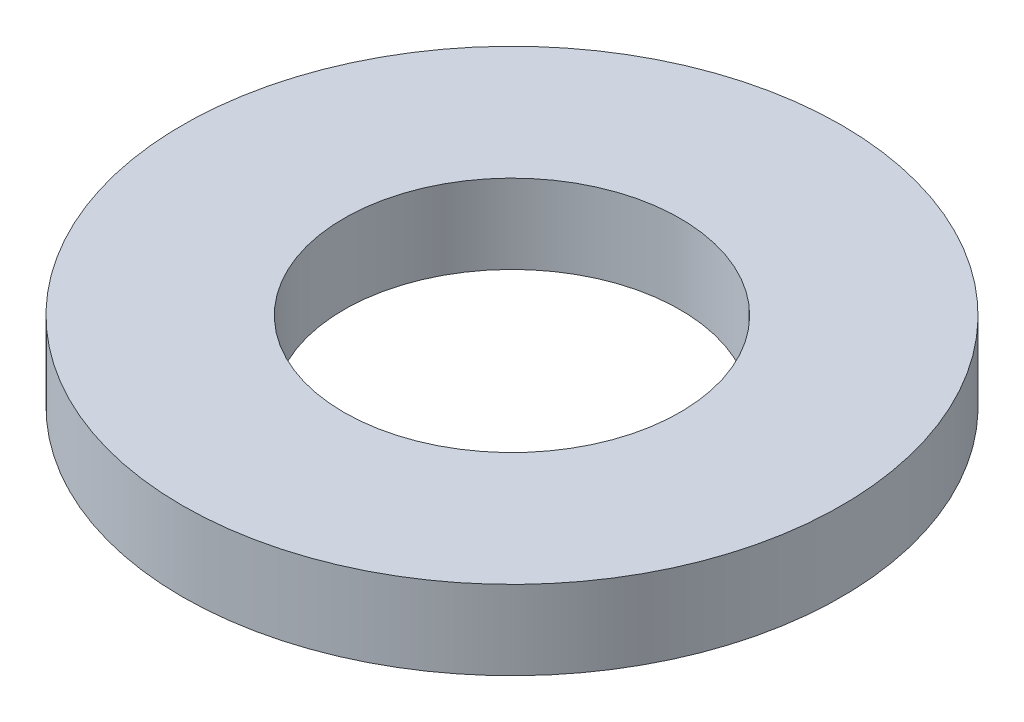
from build123d import *

# Parameters (mm, degrees)
SKETCH1_R           = 5
BOSS_EXTRUDE1_DEPTH = 1.2
SKETCH2_R           = 2.55
CUT_EXTRUDE1_DEPTH  = 1.2


with BuildPart() as part:
    # Sketch1 → Boss-Extrude1 (new body)
    with BuildSketch(Plane(origin=(0, 0, 0), x_dir=(1, 0, 0), z_dir=(0, 1, 0))):
        with Locations(Location((0, 0, 0), (0, 0, 270))):
            Circle(SKETCH1_R)
    extrude(amount=BOSS_EXTRUDE1_DEPTH)

    # Sketch2 → Cut-Extrude1 (cut)
    with BuildSketch(Plane(origin=(0, 1.2, 0), x_dir=(1, 0, 0), z_dir=(0, 1, 0))):
        with Locations(Location((0, 0, 0), (0, 0, 270))):
            Circle(SKETCH2_R)
    extrude(amount=-CUT_EXTRUDE1_DEPTH, mode=Mode.SUBTRACT)


solid = part.part
